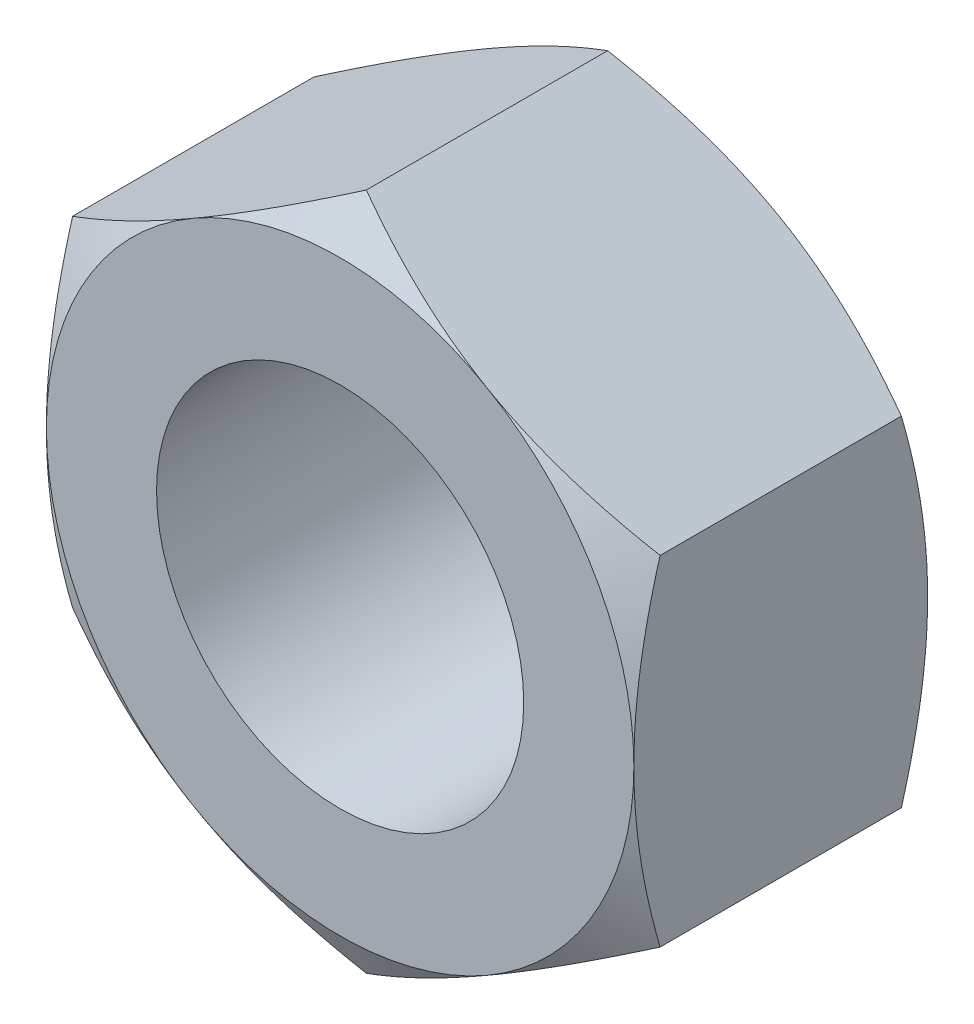
from build123d import *

# Parameters (mm, degrees)
BASE_EXTRUSION_DEPTH    = 8
ESQUISSE3_R             = 5
ENL_V_MAT_EXTRU_1_DEPTH = 15.605934867


with BuildPart() as part:
    # Esquisse1 → Base-Extrusion (new body)
    with BuildSketch(Plane.XY):
        Polygon((8, -4.618802154), (8, 4.618802154), (0, 9.237604307), (-8, 4.618802154), (-8, -4.618802154), (0, -9.237604307), align=None)
    extrude(amount=-BASE_EXTRUSION_DEPTH)

    # Esquisse2 → Enlèvement de matière-Révolution1 (revolve, cut)
    with BuildSketch(Plane(origin=(0, 0, 0), x_dir=(1, 0, 0), z_dir=(0, 1, 0))):
        Polygon((-8, 0), (-15.92820323, 0), (-15.92820323, 8), (-8, 8), (-14.92820323, 4), align=None)
    revolve(axis=Axis((0, 0, -8), (0, 0, 1)), mode=Mode.SUBTRACT)

    # Esquisse3 → Enlèv. mat.-Extru.1 (cut, through all)
    with BuildSketch(Plane.XY):
        Circle(ESQUISSE3_R)
    extrude(amount=-ENL_V_MAT_EXTRU_1_DEPTH, mode=Mode.SUBTRACT)


solid = part.part
